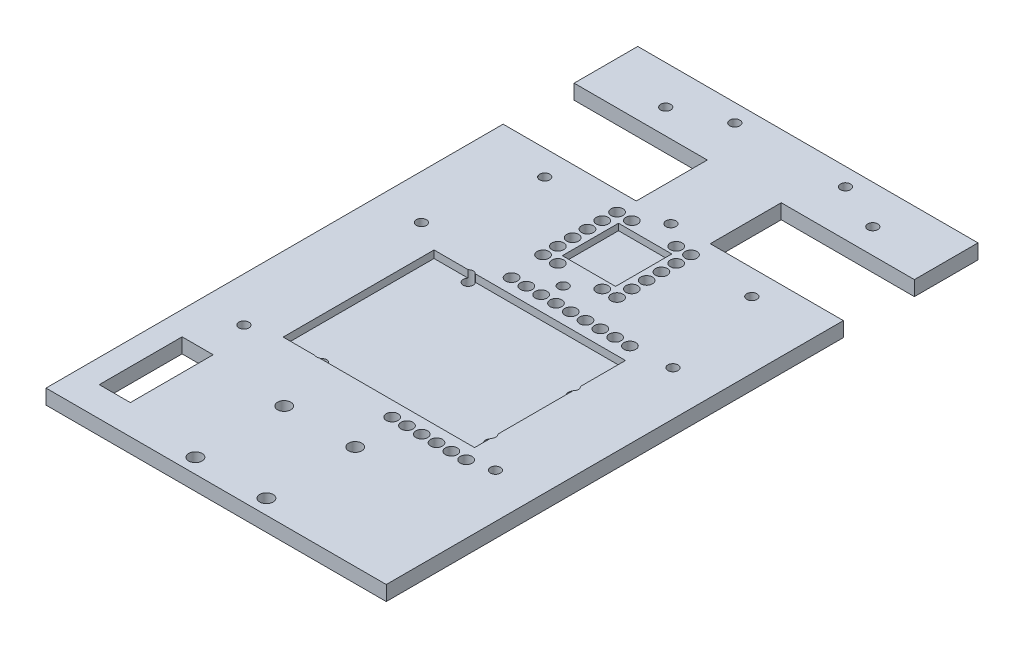
from build123d import *

# Parameters (mm, degrees)
ESBO_O1_W                   = 115
ESBO_O1_H                   = 200
RESSALTO_EXTRUS_O1_DEPTH    = 5
FURO_COM_FOLGA_DE_M41_D     = 4.5
ESBO_O5_W                   = 24
ESBO_O5_H                   = 5
CORTE_EXTRUS_O1_DEPTH       = 45
ESBO_O6_W                   = 24
ESBO_O6_H                   = 5
CORTE_EXTRUS_O2_DEPTH       = 45
ESBO_O7_W                   = 64.7
ESBO_O7_H                   = 51
CORTE_EXTRUS_O3_DEPTH       = 2.5
FURO_COM_FOLGA_DE_M31_D     = 3.4
ESBO_O10_W                  = 18
ESBO_O10_H                  = 19
CORTE_EXTRUS_O4_DEPTH       = 2.2
ESBO_O11_W                  = 10.5
ESBO_O11_H                  = 28
CORTE_EXTRUS_O5_DEPTH       = 231.759615184
FURO_COM_FOLGA_DE_M32_D     = 3.4
FURO_COM_FOLGA_DE_M33_D     = 3.4
FURO_COM_FOLGA_DE_M34_D     = 3.4
FURO_COM_FOLGA_DE_M35_D     = 3.4
FURO_COM_FOLGA_DE_M35_DEPTH = 11.25
FURO_COM_FOLGA_DE_M35_TIP   = 1.021463052
ESBO_O24_R                  = 2
CORTE_EXTRUS_O6_DEPTH       = 231.759615184
ESBO_O26_R                  = 2
CORTE_EXTRUS_O7_DEPTH       = 231.759615184
ESBO_O27_R                  = 2
CORTE_EXTRUS_O8_DEPTH       = 231.759615184


with BuildPart() as part:
    # Esboço1 → Ressalto-extrusão1 (new body)
    with BuildSketch(Plane(origin=(0, 0, 0), x_dir=(1, 0, 0), z_dir=(0, 1, 0))):
        with Locations((57.5, 100)):
            Rectangle(ESBO_O1_W, ESBO_O1_H)
    extrude(amount=RESSALTO_EXTRUS_O1_DEPTH)

    # Furo com folga de M41 (through all)
    with Locations(Plane(origin=(0, 5, 0), x_dir=(1, 0, 0), z_dir=(0, 1, 0))):
        with Locations((45.5, 5), (69.5, 5), (69.5, 35), (45.5, 35)):
            Hole(FURO_COM_FOLGA_DE_M41_D / 2)

    # Esboço5 → Corte-extrusão1 (cut)
    with BuildSketch(Plane.ZY):
        with Locations((-166.5, 2.5)):
            Rectangle(ESBO_O5_W, ESBO_O5_H)
    extrude(amount=-CORTE_EXTRUS_O1_DEPTH, mode=Mode.SUBTRACT)

    # Esboço6 → Corte-extrusão2 (cut)
    with BuildSketch(Plane(origin=(115, 0, 0), x_dir=(0, 0, -1), z_dir=(1, 0, 0))):
        with Locations((166.5, 2.5)):
            Rectangle(ESBO_O6_W, ESBO_O6_H)
    extrude(amount=-CORTE_EXTRUS_O2_DEPTH, mode=Mode.SUBTRACT)

    # Esboço7 → Corte-extrusão3 (cut)
    with BuildSketch(Plane(origin=(0, 5, 0), x_dir=(1, 0, 0), z_dir=(0, 1, 0))):
        with Locations((57.5, 80.5)):
            Rectangle(ESBO_O7_W, ESBO_O7_H)
    extrude(amount=-CORTE_EXTRUS_O3_DEPTH, mode=Mode.SUBTRACT)

    # Furo com folga de M31 (through all)
    with Locations(Plane(origin=(0, 5, 0), x_dir=(1, 0, 0), z_dir=(0, 1, 0))):
        with Locations((88.69, 61.62), (88.69, 89.56), (37.89, 104.8), (36.62, 56.54)):
            Hole(FURO_COM_FOLGA_DE_M31_D / 2)

    # Esboço10 → Corte-extrusão4 (cut)
    with BuildSketch(Plane(origin=(0, 5, 0), x_dir=(1, 0, 0), z_dir=(0, 1, 0))):
        with Locations((57.5, 135.5)):
            Rectangle(ESBO_O10_W, ESBO_O10_H)
    extrude(amount=-CORTE_EXTRUS_O4_DEPTH, mode=Mode.SUBTRACT)

    # Esboço11 → Corte-extrusão5 (cut, through all)
    with BuildSketch(Plane(origin=(0, 5, 0), x_dir=(1, 0, 0), z_dir=(0, 1, 0))):
        with Locations((13.25, 24)):
            Rectangle(ESBO_O11_W, ESBO_O11_H)
    extrude(amount=-CORTE_EXTRUS_O5_DEPTH, mode=Mode.SUBTRACT)

    # Furo com folga de M32 (through all)
    with Locations(Plane(origin=(0, 0, 0), x_dir=(-1, 0, 0), z_dir=(0, -1, 0))):
        with Locations((-15, 51.9), (-100, 51.9), (-100, 111.9), (-15, 111.9)):
            Hole(FURO_COM_FOLGA_DE_M32_D / 2)

    # Furo com folga de M33 (through all)
    with Locations(Plane(origin=(0, 5, 0), x_dir=(1, 0, 0), z_dir=(0, 1, 0))):
        with Locations((57.5, 153.7), (57.5, 117.3)):
            Hole(FURO_COM_FOLGA_DE_M33_D / 2)

    # Furo com folga de M34 (through all)
    with Locations(Plane(origin=(0, 5, 0), x_dir=(1, 0, 0), z_dir=(0, 1, 0))):
        with Locations((22.5, 186.95), (22.5, 146.05), (92.5, 186.95), (92.5, 146.05)):
            Hole(FURO_COM_FOLGA_DE_M34_D / 2)

    # Furo com folga de M35
    with Locations(Plane(origin=(0, 5, 0), x_dir=(1, 0, 0), z_dir=(0, 1, 0))):
        with Locations((76.2, 194), (38.8, 194)):
            Hole(FURO_COM_FOLGA_DE_M35_D / 2, depth=FURO_COM_FOLGA_DE_M35_DEPTH)
            with Locations((0, 0, -(FURO_COM_FOLGA_DE_M35_DEPTH + FURO_COM_FOLGA_DE_M35_TIP / 2))):  # 118° drill point
                Cone(0, FURO_COM_FOLGA_DE_M35_D / 2, FURO_COM_FOLGA_DE_M35_TIP, mode=Mode.SUBTRACT)

    # Esboço24 → Corte-extrusão6 (cut, through all)
    with BuildSketch(Plane(origin=(0, 5, 0), x_dir=(1, 0, 0), z_dir=(0, 1, 0))):
        with Locations(Location((45, 148, 0), (0, 0, 270))):
            Circle(ESBO_O24_R)
        with Locations(Location((50, 148, 0), (0, 0, 270))):
            Circle(ESBO_O24_R)
        with Locations(Location((65, 148, 0), (0, 0, 270))):
            Circle(ESBO_O24_R)
        with Locations(Location((70, 148, 0), (0, 0, 270))):
            Circle(ESBO_O24_R)
        with Locations(Location((70, 143, 0), (0, 0, 270))):
            Circle(ESBO_O24_R)
        with Locations(Location((70, 138, 0), (0, 0, 270))):
            Circle(ESBO_O24_R)
        with Locations(Location((70, 133, 0), (0, 0, 270))):
            Circle(ESBO_O24_R)
        with Locations(Location((70, 128, 0), (0, 0, 270))):
            Circle(ESBO_O24_R)
        with Locations(Location((70, 123, 0), (0, 0, 270))):
            Circle(ESBO_O24_R)
        with Locations(Location((65, 123, 0), (0, 0, 270))):
            Circle(ESBO_O24_R)
        with Locations(Location((50, 123, 0), (0, 0, 270))):
            Circle(ESBO_O24_R)
        with Locations(Location((45, 123, 0), (0, 0, 270))):
            Circle(ESBO_O24_R)
        with Locations(Location((45, 128, 0), (0, 0, 270))):
            Circle(ESBO_O24_R)
        with Locations(Location((45, 133, 0), (0, 0, 270))):
            Circle(ESBO_O24_R)
        with Locations(Location((45, 138, 0), (0, 0, 270))):
            Circle(ESBO_O24_R)
        with Locations(Location((45, 143, 0), (0, 0, 270))):
            Circle(ESBO_O24_R)
    extrude(amount=-CORTE_EXTRUS_O6_DEPTH, mode=Mode.SUBTRACT)

    # Esboço26 → Corte-extrusão7 (cut, through all)
    with BuildSketch(Plane(origin=(0, 5, 0), x_dir=(1, 0, 0), z_dir=(0, 1, 0))):
        with Locations(Location((46.35, 111, 0), (0, 0, 270))):
            Circle(ESBO_O26_R)
        with Locations(Location((51.35, 111, 0), (0, 0, 270))):
            Circle(ESBO_O26_R)
        with Locations(Location((61.35, 111, 0), (0, 0, 270))):
            Circle(ESBO_O26_R)
        with Locations(Location((66.35, 111, 0), (0, 0, 270))):
            Circle(ESBO_O26_R)
        with Locations(Location((71.35, 111, 0), (0, 0, 270))):
            Circle(ESBO_O26_R)
        with Locations(Location((81.35, 111, 0), (0, 0, 270))):
            Circle(ESBO_O26_R)
        with Locations(Location((86.35, 111, 0), (0, 0, 270))):
            Circle(ESBO_O26_R)
        with Locations(Location((56.35, 111, 0), (0, 0, 270))):
            Circle(ESBO_O26_R)
        with Locations(Location((76.35, 111, 0), (0, 0, 270))):
            Circle(ESBO_O26_R)
    extrude(amount=-CORTE_EXTRUS_O7_DEPTH, mode=Mode.SUBTRACT)

    # Esboço27 → Corte-extrusão8 (cut, through all)
    with BuildSketch(Plane(origin=(0, 5, 0), x_dir=(1, 0, 0), z_dir=(0, 1, 0))):
        with Locations(Location((92, 50, 0), (0, 0, 270))):
            Circle(ESBO_O27_R)
        with Locations(Location((82, 50, 0), (0, 0, 270))):
            Circle(ESBO_O27_R)
        with Locations(Location((67, 50, 0), (0, 0, 270))):
            Circle(ESBO_O27_R)
        with Locations(Location((77, 50, 0), (0, 0, 270))):
            Circle(ESBO_O27_R)
        with Locations(Location((72, 50, 0), (0, 0, 270))):
            Circle(ESBO_O27_R)
        with Locations(Location((87, 50, 0), (0, 0, 270))):
            Circle(ESBO_O27_R)
    extrude(amount=-CORTE_EXTRUS_O8_DEPTH, mode=Mode.SUBTRACT)


solid = part.part
